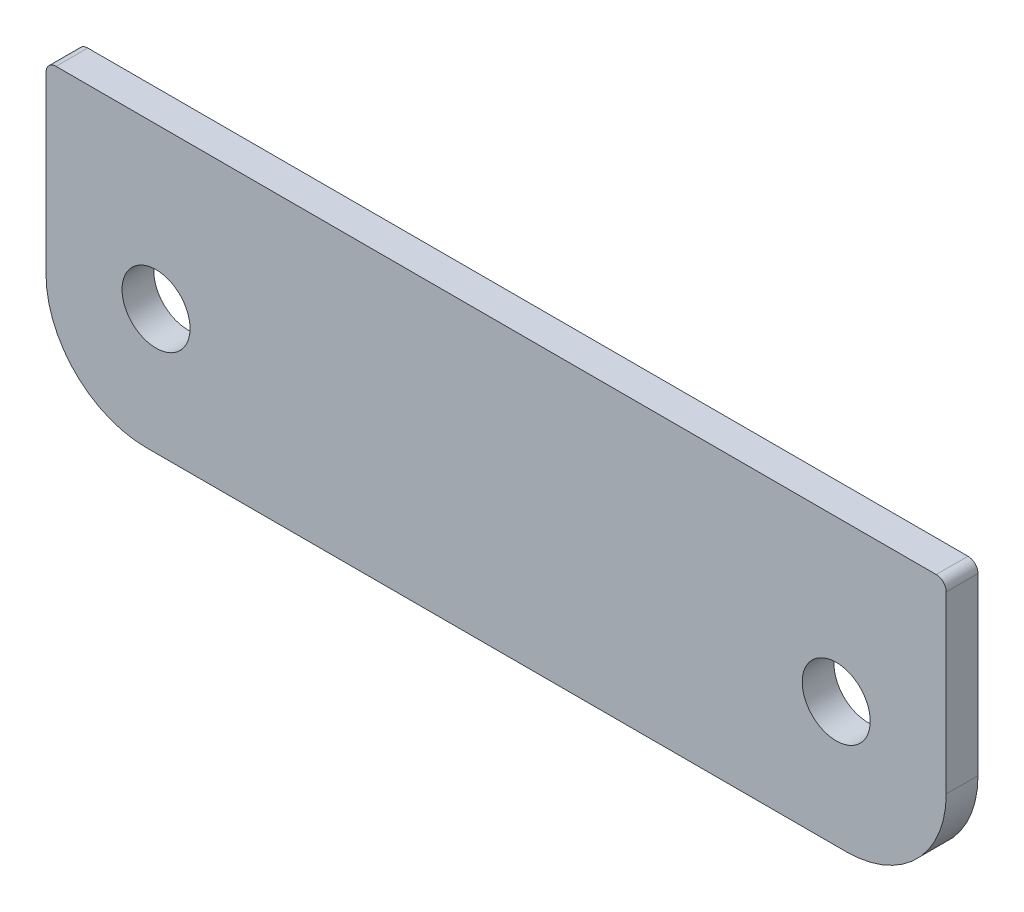
from build123d import *

# Parameters (mm, degrees)
SKETCH1_R           = 3.4
BOSS_EXTRUDE1_DEPTH = 1.5875
FILLET1_R           = 10
FILLET2_R           = 1


with BuildPart() as part:
    # Sketch1 → Boss-Extrude1 (new, symmetric)
    with BuildSketch(Plane.XY):
        Polygon((-45, 12.499999995), (-45, 15.999999995), (45, 15.999999995), (45, 12.499999995), (45, -12.499999995), (-45, -12.499999995), align=None)
        with Locations((34, 0)):
            Circle(SKETCH1_R, mode=Mode.SUBTRACT)
        with Locations((-34, 0)):
            Circle(SKETCH1_R, mode=Mode.SUBTRACT)
    extrude(amount=BOSS_EXTRUDE1_DEPTH, both=True)

    # Fillet1
    fillet1_edges = [part.edges().sort_by_distance(p)[0] for p in [
        (45, -12.499999995, 0),
        (-45, -12.499999995, 0),
    ]]
    fillet(fillet1_edges, radius=FILLET1_R)

    # Fillet2
    fillet2_edges = [part.edges().sort_by_distance(p)[0] for p in [
        (-45, 15.999999995, 0),
        (45, 15.999999995, 0),
    ]]
    fillet(fillet2_edges, radius=FILLET2_R)


solid = part.part
